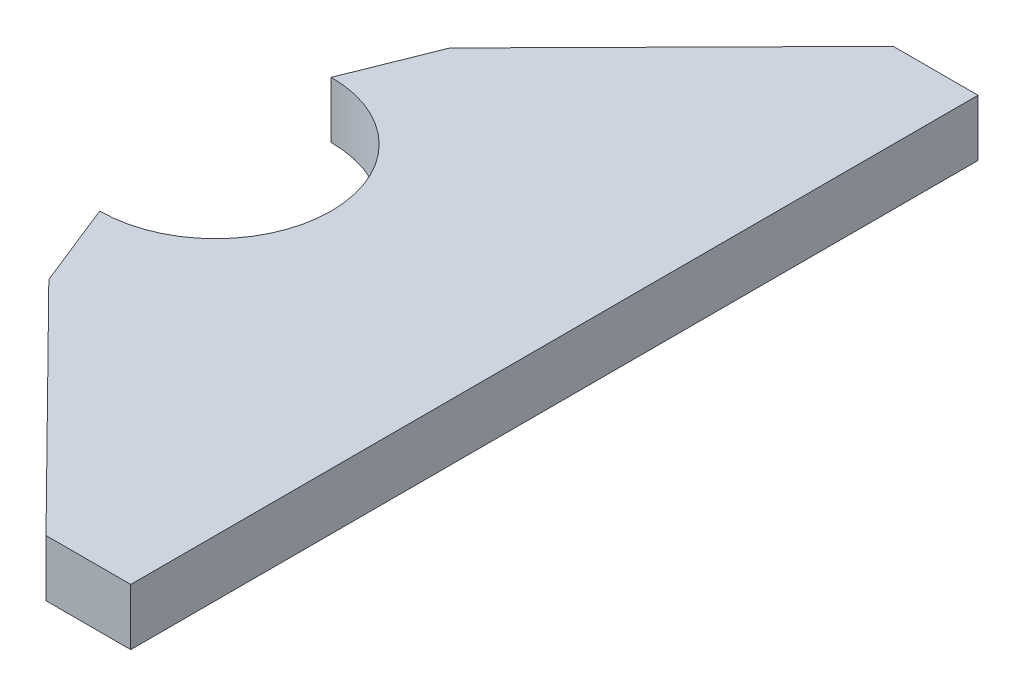
from build123d import *

# Parameters (mm, degrees)
BOSS_EXTRUDE1_DEPTH = 10


with BuildPart() as part:
    # Sketch1 → Boss-Extrude1 (new body)
    with BuildSketch(Plane(origin=(0, 0, 0), x_dir=(1, 0, 0), z_dir=(0, 1, 0))):
        with BuildLine():
            Line((-3.44629156, -20.5), (2.55370844, -35.5))
            Line((2.55370844, -35.5), (41.55370844, -75))
            Line((41.55370844, -75), (56.55370844, -75))
            Line((56.55370844, -75), (56.55370844, 75))
            Line((56.55370844, 75), (41.55370844, 75))
            Line((41.55370844, 75), (2.55370844, 35.5))
            Line((2.55370844, 35.5), (-3.44629156, 20.5))
            ThreePointArc((-3.44629156, 20.5), (17.05370844, 0), (-3.44629156, -20.5))
        make_face()
    extrude(amount=BOSS_EXTRUDE1_DEPTH)


solid = part.part
